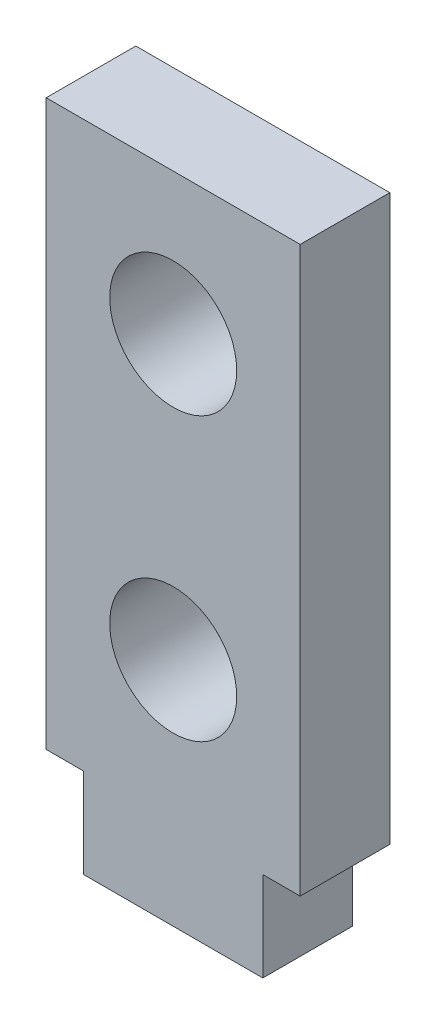
from build123d import *

# Parameters (mm, degrees)
SKETCH1_R           = 2.25
BOSS_EXTRUDE2_DEPTH = 3.175


with BuildPart() as part:
    # Sketch1 → Boss-Extrude2 (new body)
    with BuildSketch(Plane.XY):
        Polygon((0, 0), (1.325, 0), (1.325, -3.175), (7.675, -3.175), (7.675, 0), (9, 0), (9, 20), (0, 20), align=None)
        with Locations((4.5, 5)):
            Circle(SKETCH1_R, mode=Mode.SUBTRACT)
        with Locations((4.5, 15)):
            Circle(SKETCH1_R, mode=Mode.SUBTRACT)
    extrude(amount=BOSS_EXTRUDE2_DEPTH)


solid = part.part
